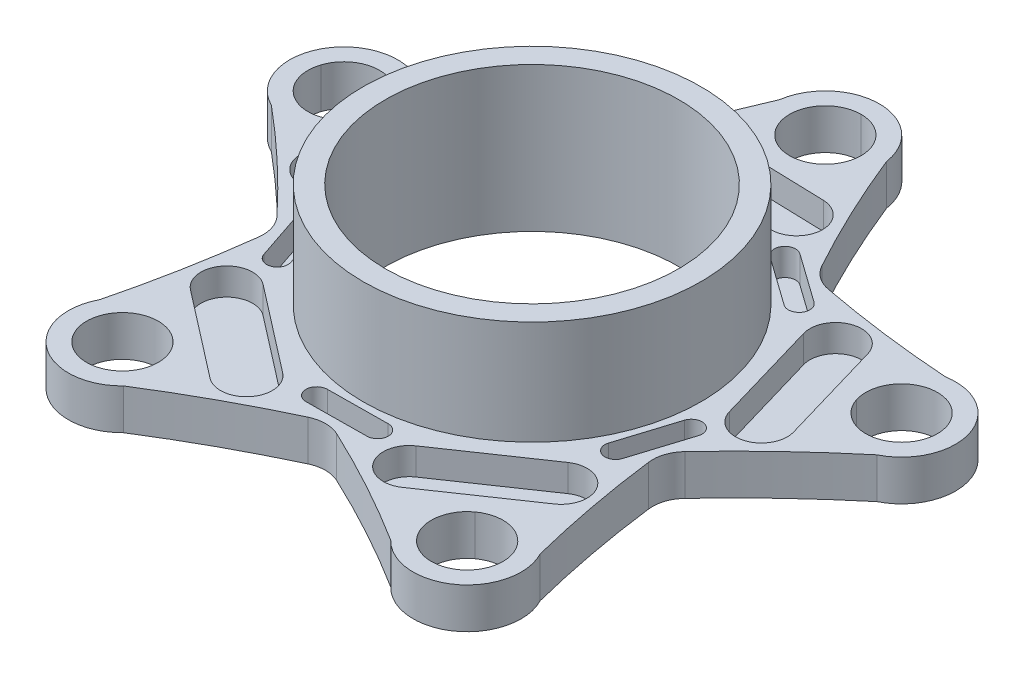
from build123d import *

# Parameters (mm, degrees)
SKETCH1_R                 = 31.75
CENTERCIRCLEEXTRUDE_DEPTH = 19.558
SKETCH2_R                 = 80.01
BASEEXPAND_DEPTH          = 7.62
SKETCH3_R                 = 27.559
CENTERCUT_DEPTH           = 27.178
SKETCH4_R                 = 6.731
OUTERCIRCLECUT_DEPTH      = 7.62
SKETCH8_R                 = 80.01
STARFISHCUT_DEPTH         = 7.62
BATMAN_CUT_DEPTH          = 5.08
FILLET12_R                = 6.35


with BuildPart() as part:
    # Sketch1 → CenterCircleExtrude (new body)
    with BuildSketch(Plane(origin=(0, 0, 0), x_dir=(1, 0, 0), z_dir=(0, 1, 0))):
        Circle(SKETCH1_R)
    extrude(amount=CENTERCIRCLEEXTRUDE_DEPTH)

    # Sketch2 → BaseExpand (add)
    with BuildSketch(Plane.XZ):
        Circle(SKETCH2_R)
    extrude(amount=BASEEXPAND_DEPTH)

    # Sketch3 → CenterCut (cut)
    with BuildSketch(Plane(origin=(0, 19.558, 0), x_dir=(1, 0, 0), z_dir=(0, 1, 0))):
        Circle(SKETCH3_R)
    extrude(amount=-CENTERCUT_DEPTH, mode=Mode.SUBTRACT)

    # Sketch4 → OuterCircleCut (cut)
    with BuildSketch(Plane(origin=(0, 0, 0), x_dir=(1, 0, 0), z_dir=(0, 1, 0))):
        with Locations((0, 55.118)):
            Circle(SKETCH4_R)
        with Locations((52.420333065, 17.032398696)):
            Circle(SKETCH4_R)
        with Locations((32.397547536, -44.591398696)):
            Circle(SKETCH4_R)
        with Locations((-32.397547536, -44.591398696)):
            Circle(SKETCH4_R)
        with Locations((-52.420333065, 17.032398696)):
            Circle(SKETCH4_R)
    extrude(amount=-OUTERCIRCLECUT_DEPTH, mode=Mode.SUBTRACT)

    # Sketch8 → StarfishCut (cut)
    with BuildSketch(Plane(origin=(0, 0, 0), x_dir=(1, 0, 0), z_dir=(0, 1, 0))):
        Circle(SKETCH8_R)
        with BuildLine():
            ThreePointArc((-60.451485692, 10.809361858), (-62.083067271, 20.172011359), (-55.259862746, 26.787534327))
            ThreePointArc((-55.259862746, 26.787534327), (-52.990125634, 27.176408575), (-50.691117004, 27.044162367))
            ThreePointArc((-50.691117004, 27.044162367), (-36.498445494, 28.482280038), (-22.436174146, 30.88074446))
            ThreePointArc((-22.436174146, 30.88074446), (-15.809618103, 43.513592992), (-10.056110229, 56.567222915))
            ThreePointArc((-10.056110229, 56.567222915), (-9.47145111, 58.794576379), (-8.400222382, 60.833055899))
            ThreePointArc((-8.400222382, 60.833055899), (0, 65.278), (8.400222382, 60.833055899))
            ThreePointArc((8.400222382, 60.833055899), (9.47145111, 58.794576379), (10.056110229, 56.567222915))
            ThreePointArc((10.056110229, 56.567222915), (15.809618103, 43.513592992), (22.436174146, 30.88074446))
            ThreePointArc((22.436174146, 30.88074446), (36.498445494, 28.482280038), (50.691117004, 27.044162367))
            ThreePointArc((50.691117004, 27.044162367), (52.990125634, 27.176408575), (55.259862746, 26.787534327))
            ThreePointArc((55.259862746, 26.787534327), (60.546685924, 23.130594267), (62.580333065, 17.032398696))
            ThreePointArc((62.580333065, 17.032398696), (62.033399971, 13.743851196), (60.451485692, 10.809361858))
            ThreePointArc((60.451485692, 10.809361858), (58.843804343, 9.160637981), (56.90613492, 7.916304043))
            ThreePointArc((56.90613492, 7.916304043), (46.26932683, -1.589400596), (36.302492346, -11.795394786))
            ThreePointArc((36.302492346, -11.795394786), (38.366897955, -25.910575851), (41.384943465, -39.853011375))
            ThreePointArc((41.384943465, -39.853011375), (42.22114982, -41.998632188), (42.552695773, -44.27744921))
            ThreePointArc((42.552695773, -44.27744921), (42.556334523, -44.434405209), (42.557547536, -44.591398696))
            ThreePointArc((42.557547536, -44.591398696), (38.241722309, -52.902308467), (28.960850446, -54.152502874))
            ThreePointArc((28.960850446, -54.152502874), (26.896020001, -53.132990748), (25.11381532, -51.674677951))
            ThreePointArc((25.11381532, -51.674677951), (12.786398515, -44.495896582), (0, -38.170699348))
            ThreePointArc((0, -38.170699348), (-12.786398515, -44.495896582), (-25.11381532, -51.674677951))
            ThreePointArc((-25.11381532, -51.674677951), (-26.896020001, -53.132990748), (-28.960850446, -54.152502874))
            ThreePointArc((-28.960850446, -54.152502874), (-38.369445699, -52.811011359), (-42.552695773, -44.27744921))
            ThreePointArc((-42.552695773, -44.27744921), (-42.22114982, -41.998632188), (-41.384943465, -39.853011375))
            ThreePointArc((-41.384943465, -39.853011375), (-38.366897955, -25.910575851), (-36.302492346, -11.795394786))
            ThreePointArc((-36.302492346, -11.795394786), (-46.26932683, -1.589400596), (-56.90613492, 7.916304043))
            ThreePointArc((-56.90613492, 7.916304043), (-58.843804343, 9.160637981), (-60.451485692, 10.809361858))
        make_face(mode=Mode.SUBTRACT)
    extrude(amount=-STARFISHCUT_DEPTH, mode=Mode.SUBTRACT)

    # Sketch14 → Batman Cut (cut)
    with BuildSketch(Plane(origin=(0, 0, 0), x_dir=(1, 0, 0), z_dir=(0, 1, 0))):
        with BuildLine():
            Line((-33.120038048, -5.061770157), (-29.510136252, -15.81140749))
            ThreePointArc((-29.510136252, -15.81140749), (-30.777930128, -18.361212827), (-33.327735465, -17.093418951))
            Line((-33.327735465, -17.093418951), (-36.937637261, -6.343781617))
            ThreePointArc((-36.937637261, -6.343781617), (-35.669843385, -3.793976281), (-33.120038048, -5.061770157))
        make_face()
        with BuildLine():
            Line((-15.048684103, 29.934855006), (-24.156675734, 23.17981376))
            ThreePointArc((-24.156675734, 23.17981376), (-26.973454567, 23.597624206), (-26.555644121, 26.414403039))
            Line((-26.555644121, 26.414403039), (-17.447652491, 33.169444285))
            ThreePointArc((-17.447652491, 33.169444285), (-14.630873657, 32.751633839), (-15.048684103, 29.934855006))
        make_face()
        with BuildLine():
            Line((23.819439787, 23.562527999), (14.580489593, 30.137320247))
            ThreePointArc((14.580489593, 30.137320247), (14.107418412, 32.94534664), (16.915444805, 33.418417821))
            Line((16.915444805, 33.418417821), (26.154394998, 26.843625573))
            ThreePointArc((26.154394998, 26.843625573), (26.62746618, 24.03559918), (23.819439787, 23.562527999))
        make_face()
        with BuildLine():
            Line((29.769907484, -15.372411842), (33.167913875, -4.553925517))
            ThreePointArc((33.167913875, -4.553925517), (35.692318639, -3.236280211), (37.009963945, -5.760684975))
            Line((37.009963945, -5.760684975), (33.611957554, -16.5791713))
            ThreePointArc((33.611957554, -16.5791713), (31.08755279, -17.896816606), (29.769907484, -15.372411842))
        make_face()
        with BuildLine():
            Line((-5.42062512, -33.063201006), (5.918408517, -32.951800999))
            ThreePointArc((5.918408517, -32.951800999), (7.951647645, -34.945477807), (5.957970836, -36.978716935))
            Line((5.957970836, -36.978716935), (-5.381062801, -37.090116942))
            ThreePointArc((-5.381062801, -37.090116942), (-7.414301928, -35.096440133), (-5.42062512, -33.063201006))
        make_face()
        with BuildLine():
            Line((-28.525313555, -22.027493495), (-12.265879706, -34.597736013))
            ThreePointArc((-12.265879706, -34.597736013), (-11.392472024, -41.423096527), (-18.217832537, -42.29650421))
            Line((-18.217832537, -42.29650421), (-34.477266386, -29.726261691))
            ThreePointArc((-34.477266386, -29.726261691), (-35.350674069, -22.900901178), (-28.525313555, -22.027493495))
        make_face()
        with BuildLine():
            Line((-29.764197885, 20.322315503), (-36.694767565, 0.974256428))
            ThreePointArc((-36.694767565, 0.974256428), (-42.91617334, -1.965556032), (-45.8559858, 4.255849744))
            Line((-45.8559858, 4.255849744), (-38.925416119, 23.603908818))
            ThreePointArc((-38.925416119, 23.603908818), (-32.704010344, 26.543721278), (-29.764197885, 20.322315503))
        make_face()
        with BuildLine():
            Line((10.130027615, 34.587375206), (-10.412733858, 35.1998596))
            ThreePointArc((-10.412733858, 35.1998596), (-15.131181768, 40.208316093), (-10.122725275, 44.926764002))
            Line((-10.122725275, 44.926764002), (10.420036198, 44.314279608))
            ThreePointArc((10.420036198, 44.314279608), (15.138484108, 39.305823116), (10.130027615, 34.587375206))
        make_face()
        with BuildLine():
            Line((36.024899257, 1.053857956), (30.259344125, 20.780453204))
            ThreePointArc((30.259344125, 20.780453204), (33.564588718, 26.815662007), (39.599797521, 23.510417414))
            Line((39.599797521, 23.510417414), (45.365352654, 3.783822167))
            ThreePointArc((45.365352654, 3.783822167), (42.060108061, -2.251386637), (36.024899257, 1.053857956))
        make_face()
        with BuildLine():
            Line((12.134584568, -33.93605517), (29.114037004, -22.356833218))
            ThreePointArc((29.114037004, -22.356833218), (35.875238414, -23.635325541), (34.596746091, -30.396526951))
            Line((34.596746091, -30.396526951), (17.617293654, -41.975748902))
            ThreePointArc((17.617293654, -41.975748902), (10.856092244, -40.697256579), (12.134584568, -33.93605517))
        make_face()
    extrude(amount=-BATMAN_CUT_DEPTH, mode=Mode.SUBTRACT)

    # Fillet12
    fillet12_edges = [part.edges().sort_by_distance(p)[0] for p in [
        (-36.302492346, -3.81, 11.795394786),
        (0, -3.81, 38.170699348),
        (36.302492346, -3.81, 11.795394786),
        (22.436174146, -3.81, -30.88074446),
        (-22.436174146, -3.81, -30.88074446),
    ]]
    fillet(fillet12_edges, radius=FILLET12_R)


solid = part.part
